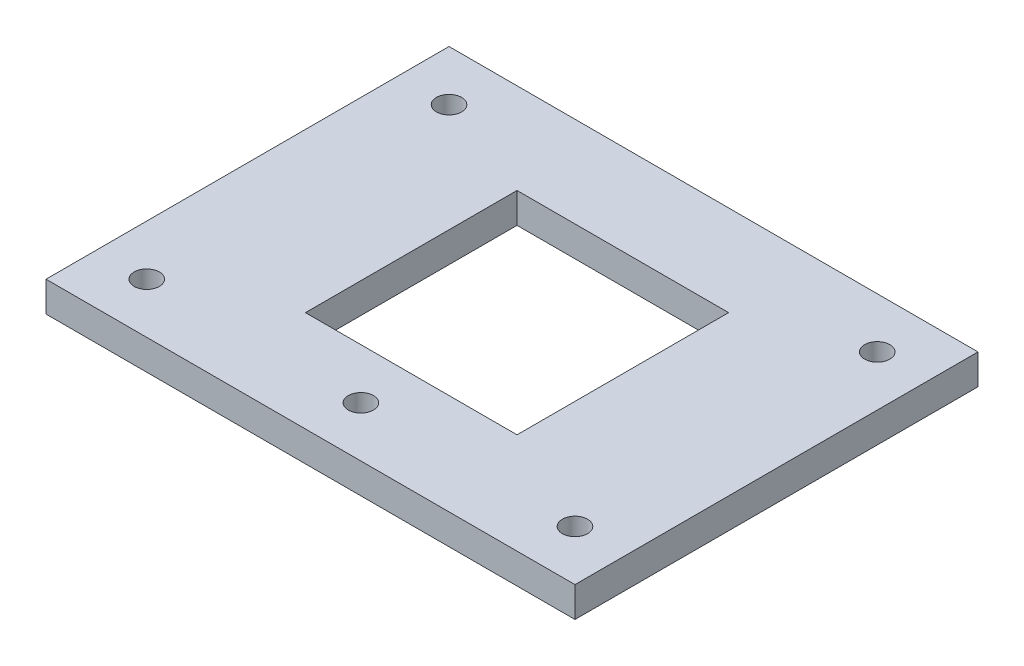
from build123d import *

# Parameters (mm, degrees)
BOSS_EXTRUDE1_DEPTH = 6
SKETCH2_R           = 2.5
SKETCH2_W           = 42
SKETCH2_H           = 42
CUT_EXTRUDE1_DEPTH  = 96.876222287


with BuildPart() as part:
    # Sketch1 → Boss-Extrude1 (new body)
    with BuildSketch(Plane(origin=(0, 0, 0), x_dir=(1, 0, 0), z_dir=(0, 1, 0))):
        Polygon((0, 0), (-52.5, 0), (-52.5, 80), (52.5, 80), (52.5, 0), align=None)
    extrude(amount=BOSS_EXTRUDE1_DEPTH)

    # Sketch2 → Cut-Extrude1 (cut, through all)
    with BuildSketch(Plane(origin=(0, 6, 0), x_dir=(1, 0, 0), z_dir=(0, 1, 0))):
        with Locations(Location((-42.5, 70, 0), (0, 0, 270))):
            Circle(SKETCH2_R)
        with Locations(Location((42.5, 70, 0), (0, 0, 270))):
            Circle(SKETCH2_R)
        with Locations(Location((42.5, 10, 0), (0, 0, 270))):
            Circle(SKETCH2_R)
        with Locations(Location((0, 10, 0), (0, 0, 270))):
            Circle(SKETCH2_R)
        with Locations(Location((-42.5, 10, 0), (0, 0, 270))):
            Circle(SKETCH2_R)
        with Locations((0, 41)):
            Rectangle(SKETCH2_W, SKETCH2_H)
    extrude(amount=-CUT_EXTRUDE1_DEPTH, mode=Mode.SUBTRACT)


solid = part.part
